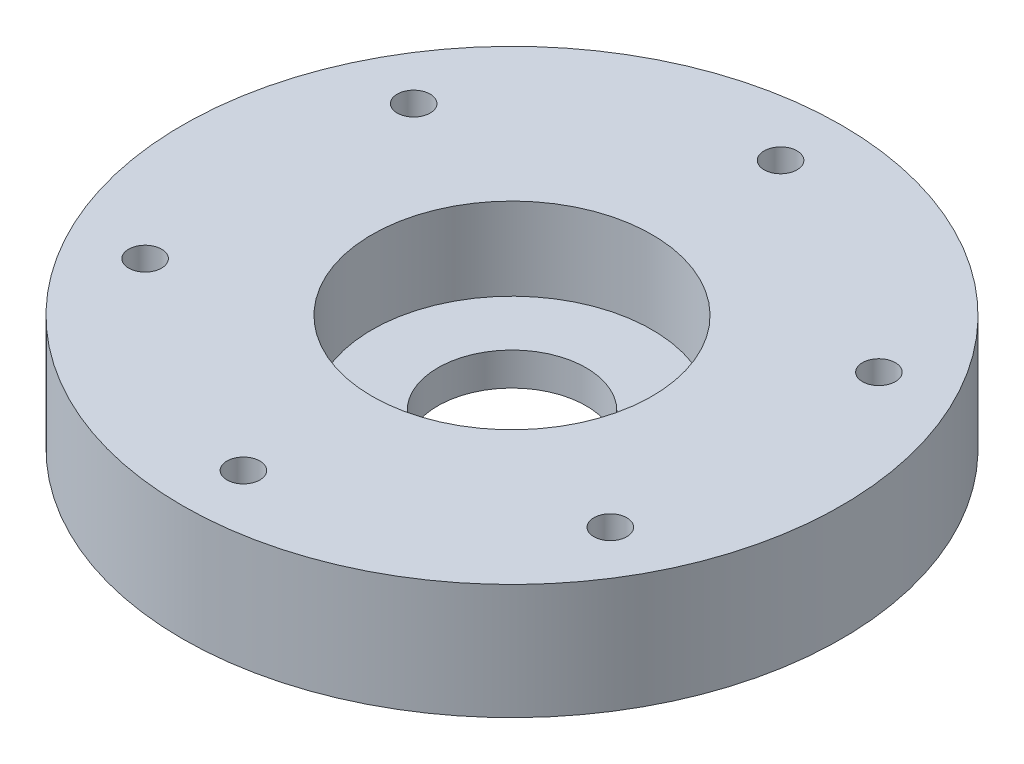
from build123d import *

# Parameters (mm, degrees)
SKETCH1_R           = 20
BOSS_EXTRUDE1_DEPTH = 7
SKETCH2_R           = 8.5
CUT_EXTRUDE1_DEPTH  = 5
SKETCH3_R           = 4.5
CUT_EXTRUDE2_DEPTH  = 30.137604569
SKETCH4_R           = 1
CUT_EXTRUDE3_DEPTH  = 4
CUT_EXTRUDE4_DEPTH  = 1.7


with BuildPart() as part:
    # Sketch1 → Boss-Extrude1 (new body)
    with BuildSketch(Plane(origin=(0, 0, 0), x_dir=(1, 0, 0), z_dir=(0, 1, 0))):
        with Locations(Location((0, 0, 0), (0, 0, 270))):
            Circle(SKETCH1_R)
    extrude(amount=BOSS_EXTRUDE1_DEPTH)

    # Sketch2 → Cut-Extrude1 (cut)
    with BuildSketch(Plane(origin=(0, 7, 0), x_dir=(1, 0, 0), z_dir=(0, 1, 0))):
        with Locations(Location((0, 0, 0), (0, 0, 270))):
            Circle(SKETCH2_R)
    extrude(amount=-CUT_EXTRUDE1_DEPTH, mode=Mode.SUBTRACT)

    # Sketch3 → Cut-Extrude2 (cut, through all)
    with BuildSketch(Plane(origin=(0, 7, 0), x_dir=(1, 0, 0), z_dir=(0, 1, 0))):
        with Locations(Location((0, 0, 0), (0, 0, 270))):
            Circle(SKETCH3_R)
    extrude(amount=-CUT_EXTRUDE2_DEPTH, mode=Mode.SUBTRACT)

    # Sketch4 → Cut-Extrude3 (cut)
    with BuildSketch(Plane(origin=(0, 7, 0), x_dir=(1, 0, 0), z_dir=(0, 1, 0))):
        with Locations(Location((0, 16.3, 0), (0, 0, 270))):
            Circle(SKETCH4_R)
        with Locations(Location((14.116214082, 8.15, 0), (0, 0, 270))):
            Circle(SKETCH4_R)
        with Locations(Location((14.116214082, -8.15, 0), (0, 0, 270))):
            Circle(SKETCH4_R)
        with Locations(Location((0, -16.3, 0), (0, 0, 270))):
            Circle(SKETCH4_R)
        with Locations(Location((-14.116214082, -8.15, 0), (0, 0, 270))):
            Circle(SKETCH4_R)
        with Locations(Location((-14.116214082, 8.15, 0), (0, 0, 270))):
            Circle(SKETCH4_R)
    extrude(amount=-CUT_EXTRUDE3_DEPTH, mode=Mode.SUBTRACT)

    # Sketch5 → Cut-Extrude4 (cut)
    with BuildSketch(Plane(origin=(0, 3, 0), x_dir=(1, 0, 0), z_dir=(0, 1, 0))):
        Polygon((12.116214082, 6.995299462), (14.116214082, 5.840598923), (16.116214082, 6.995299462), (16.116214082, 9.304700538), (14.116214082, 10.459401077), (12.116214082, 9.304700538), align=None)
        Polygon((0, 13.990598923), (2, 15.145299462), (2, 17.454700538), (0, 18.609401077), (-2, 17.454700538), (-2, 15.145299462), align=None)
        Polygon((12.116214082, -6.995299462), (12.116214082, -9.304700538), (14.116214082, -10.459401077), (16.116214082, -9.304700538), (16.116214082, -6.995299462), (14.116214082, -5.840598923), align=None)
        Polygon((0, -13.990598923), (-2, -15.145299462), (-2, -17.454700538), (0, -18.609401077), (2, -17.454700538), (2, -15.145299462), align=None)
        Polygon((-12.116214082, -6.995299462), (-14.116214082, -5.840598923), (-16.116214082, -6.995299462), (-16.116214082, -9.304700538), (-14.116214082, -10.459401077), (-12.116214082, -9.304700538), align=None)
        Polygon((-12.116214082, 6.995299462), (-12.116214082, 9.304700538), (-14.116214082, 10.459401077), (-16.116214082, 9.304700538), (-16.116214082, 6.995299462), (-14.116214082, 5.840598923), align=None)
    extrude(amount=CUT_EXTRUDE4_DEPTH, mode=Mode.SUBTRACT)


solid = part.part
